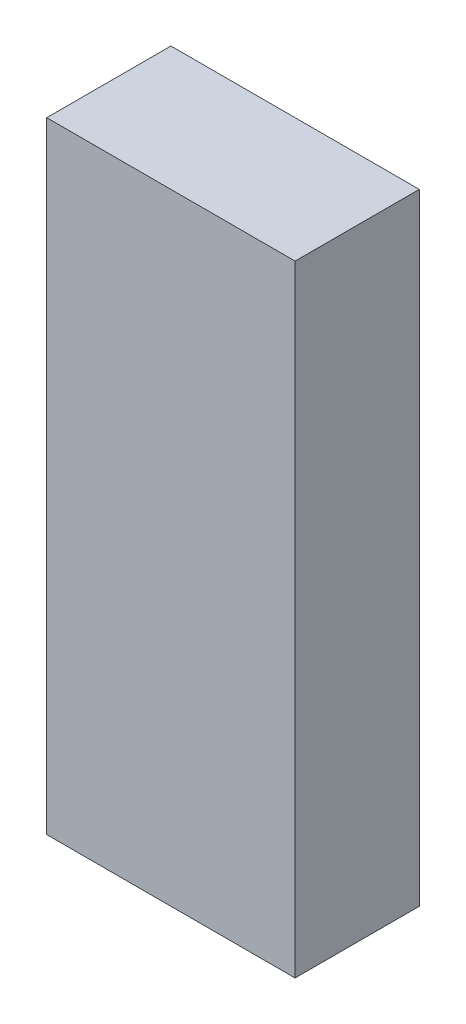
from build123d import *

# Parameters (mm, degrees)
SKETCH1_W           = 20
SKETCH1_H           = 50
BOSS_EXTRUDE1_DEPTH = 10


with BuildPart() as part:
    # Sketch1 → Boss-Extrude1 (new body)
    with BuildSketch(Plane.XY):
        Rectangle(SKETCH1_W, SKETCH1_H)
    extrude(amount=BOSS_EXTRUDE1_DEPTH)


solid = part.part
